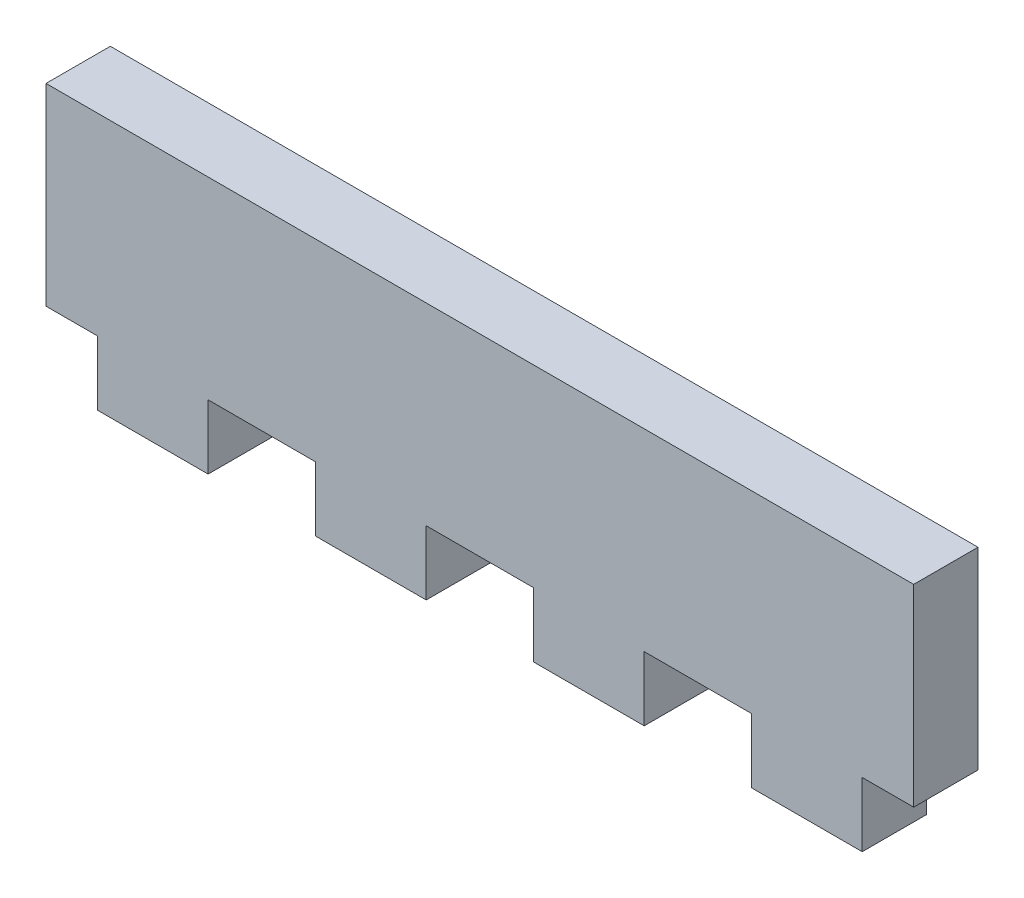
from build123d import *

# Parameters (mm, degrees)
BOSS_EXTRUDE1_DEPTH = 5


with BuildPart() as part:
    # Sketch1 → Boss-Extrude1 (new body)
    with BuildSketch(Plane.XY):
        Polygon((5.735635818, 29.861174677), (-2.865064182, 29.861174677), (-2.865064182, 34.861174677), (-11.211864182, 34.861174677), (-11.211864182, 29.861174677), (-19.816064182, 29.861174677), (-19.816064182, 34.861174677), (-28.162764182, 34.861174677), (-28.162764182, 29.861174677), (-36.767064182, 29.861174677), (-36.767064182, 34.861174677), (-40.767064182, 34.861174677), (-40.767064182, 49.861174677), (26.683135818, 49.861174677), (26.683135818, 34.861174677), (22.683135818, 34.861174677), (22.683135818, 29.861174677), (14.082435818, 29.861174677), (14.082435818, 34.861174677), (5.735635818, 34.861174677), align=None)
    extrude(amount=BOSS_EXTRUDE1_DEPTH)


solid = part.part
